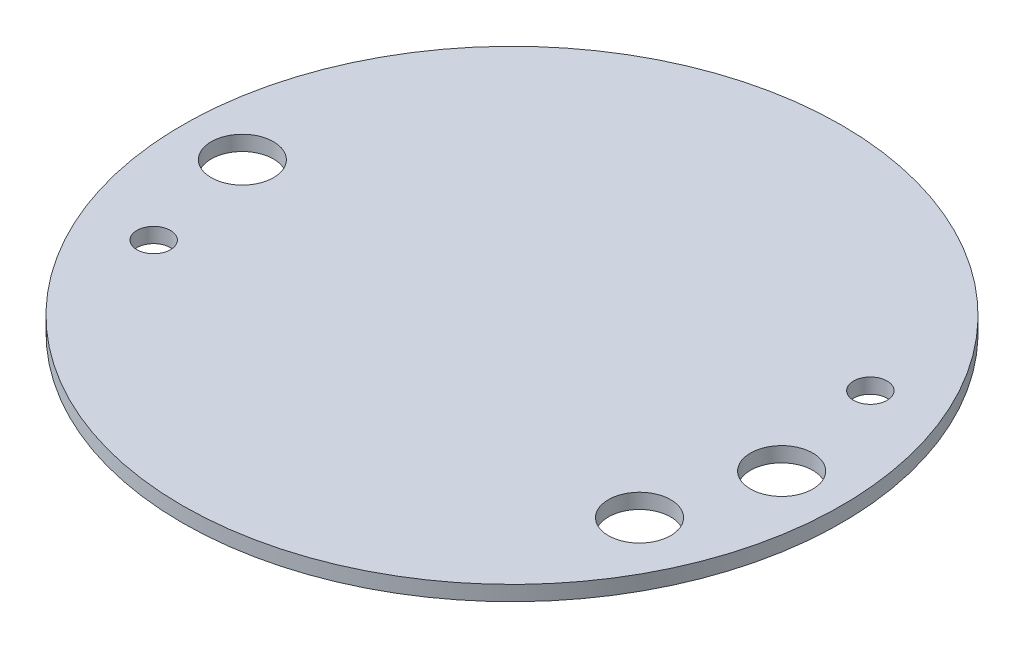
from build123d import *

# Parameters (mm, degrees)
SKETCH1_R           = 69.85
BOSS_EXTRUDE1_DEPTH = 3.175
SKETCH2_R           = 3.556
SKETCH2_R_2         = 6.604
CUT_EXTRUDE1_DEPTH  = 3.175


with BuildPart() as part:
    # Sketch1 → Boss-Extrude1 (new body)
    with BuildSketch(Plane(origin=(0, 0, 0), x_dir=(1, 0, 0), z_dir=(0, 1, 0))):
        with Locations(Location((0, 0, 0), (0, 0, 270))):
            Circle(SKETCH1_R)
    extrude(amount=BOSS_EXTRUDE1_DEPTH)

    # Sketch2 → Cut-Extrude1 (cut)
    with BuildSketch(Plane(origin=(0, 3.175, 0), x_dir=(1, 0, 0), z_dir=(0, 1, 0))):
        with Locations(Location((-51.795490029, -24.152633658, 0), (0, 0, 270))):
            Circle(SKETCH2_R)
        with Locations(Location((51.795490029, 24.152633658, 0), (0, 0, 270))):
            Circle(SKETCH2_R)
        with Locations(Location((-57.15, 0, 0), (0, 0, 270))):
            Circle(SKETCH2_R_2)
        with Locations(Location((57.15, 0, 0), (0, 0, 270))):
            Circle(SKETCH2_R_2)
        with Locations(Location((50.64447914, -23.615908466, 0), (0, 0, 270))):
            Circle(SKETCH2_R_2)
    extrude(amount=-CUT_EXTRUDE1_DEPTH, mode=Mode.SUBTRACT)


solid = part.part
